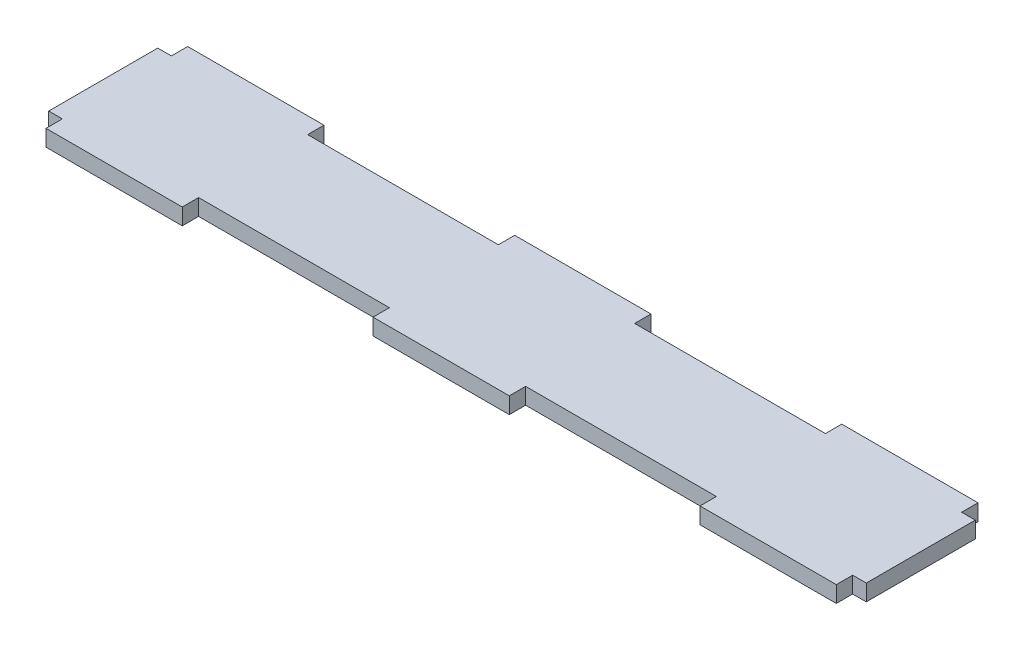
from build123d import *

# Parameters (mm, degrees)
SKETCH_1_W      = 150
SKETCH_1_H      = 20
SKETCH_1_W_2    = 25
SKETCH_1_H_2    = 3
EXTRUDE_1_DEPTH = 3


with BuildPart() as part:
    # 草图1 → 凸台-拉伸1 (new body)
    with BuildSketch(Plane(origin=(0, 0, 0), x_dir=(1, 0, 0), z_dir=(0, 1, 0))):
        Rectangle(SKETCH_1_W, SKETCH_1_H)
        with Locations((-60, 11.5)):
            Rectangle(SKETCH_1_W_2, SKETCH_1_H_2)
        with Locations((-60, -11.5)):
            Rectangle(SKETCH_1_W_2, SKETCH_1_H_2)
        with Locations((0, -11.5)):
            Rectangle(SKETCH_1_W_2, SKETCH_1_H_2)
        with Locations((0, 11.5)):
            Rectangle(SKETCH_1_W_2, SKETCH_1_H_2)
        with Locations((60, 11.5)):
            Rectangle(SKETCH_1_W_2, SKETCH_1_H_2)
        with Locations((60, -11.5)):
            Rectangle(SKETCH_1_W_2, SKETCH_1_H_2)
    extrude(amount=EXTRUDE_1_DEPTH)


solid = part.part
